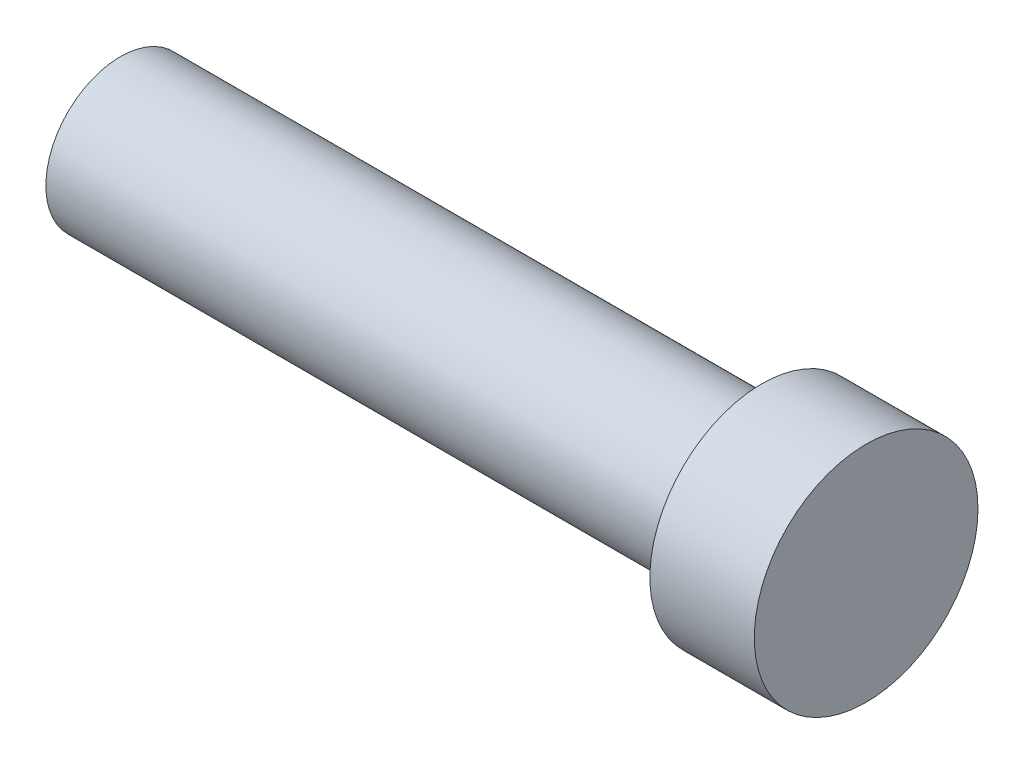
from build123d import *

# Parameters (mm, degrees)
SKETCH1_R           = 7.5
SKETCH1_R_2         = 5
BOSS_EXTRUDE1_DEPTH = 7
SKETCH1_2_R         = 5
BOSS_EXTRUDE2_DEPTH = 50


with BuildPart() as part:
    # Sketch1 → Boss-Extrude1 (new body)
    with BuildSketch(Plane(origin=(0, 0, 0), x_dir=(0, 0, -1), z_dir=(1, 0, 0))):
        Circle(SKETCH1_R)
        Circle(SKETCH1_R_2, mode=Mode.SUBTRACT)
    extrude(amount=-BOSS_EXTRUDE1_DEPTH)

    # Sketch1<2> → Boss-Extrude2 (add)
    with BuildSketch(Plane(origin=(0, 0, 0), x_dir=(0, 0, -1), z_dir=(1, 0, 0))):
        Circle(SKETCH1_2_R)
    extrude(amount=-BOSS_EXTRUDE2_DEPTH)


solid = part.part
